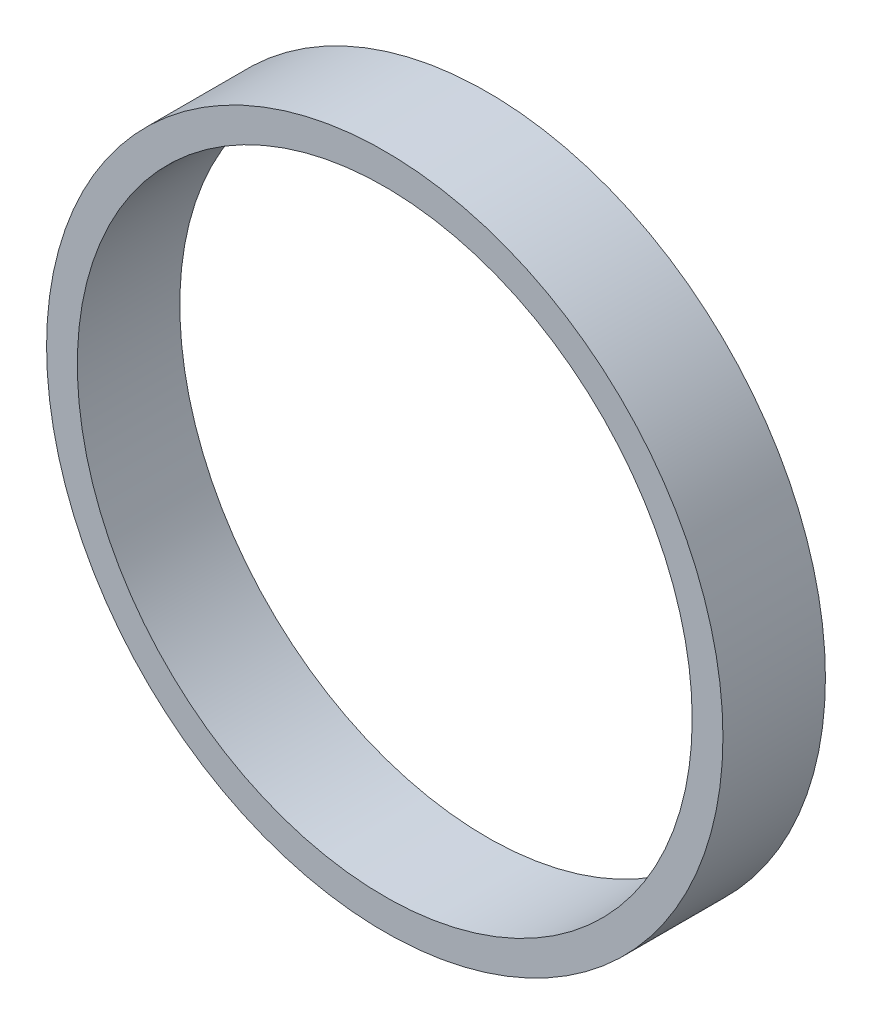
from build123d import *

# Parameters (mm, degrees)
SKETCH1_R           = 16.5
SKETCH1_R_2         = 15
BOSS_EXTRUDE1_DEPTH = 5


with BuildPart() as part:
    # Sketch1 → Boss-Extrude1 (new body)
    with BuildSketch(Plane.XY):
        Circle(SKETCH1_R)
        Circle(SKETCH1_R_2, mode=Mode.SUBTRACT)
    extrude(amount=BOSS_EXTRUDE1_DEPTH)


solid = part.part
